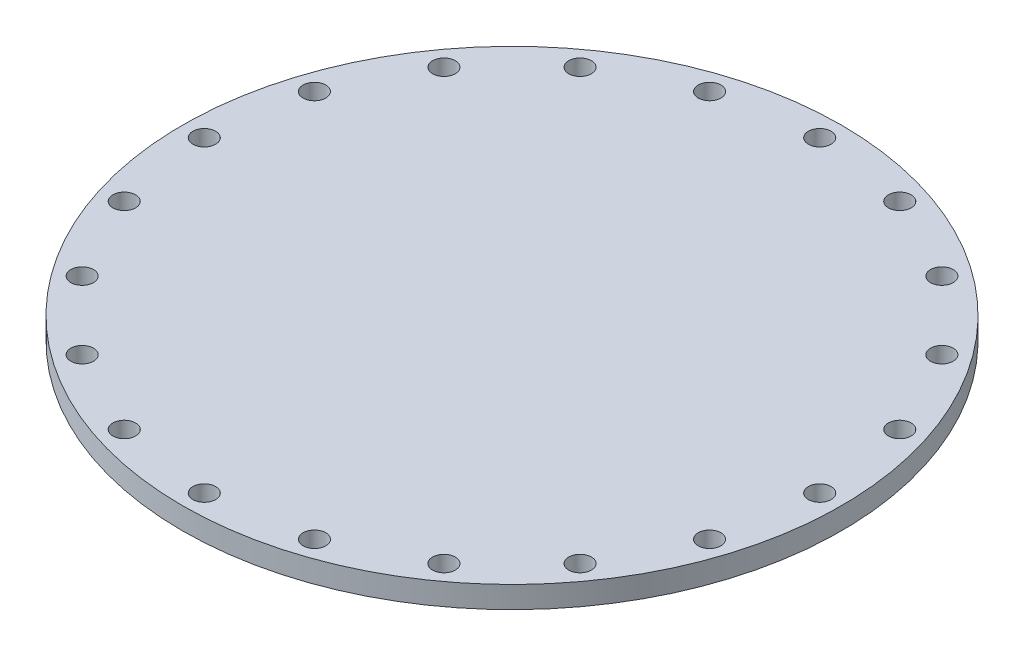
from build123d import *

# Parameters (mm, degrees)
SKETCH1_R           = 377.5
SKETCH1_R_2         = 13
BOSS_EXTRUDE1_DEPTH = 12.5


with BuildPart() as part:
    # Sketch1 → Boss-Extrude1 (new, symmetric)
    with BuildSketch(Plane(origin=(0, 0, 0), x_dir=(1, 0, 0), z_dir=(0, 1, 0))):
        with Locations(Location((0, 0, 0), (0, 0, 270))):
            Circle(SKETCH1_R)
        with Locations(Location((0, 352.5, 0), (0, 0, 270))):
            Circle(SKETCH1_R_2, mode=Mode.SUBTRACT)
        with Locations(Location((108.928490517, 335.247421994, 0), (0, 0, 270))):
            Circle(SKETCH1_R_2, mode=Mode.SUBTRACT)
        with Locations(Location((207.194301433, 285.178490517, 0), (0, 0, 270))):
            Circle(SKETCH1_R_2, mode=Mode.SUBTRACT)
        with Locations(Location((285.178490517, 207.194301433, 0), (0, 0, 270))):
            Circle(SKETCH1_R_2, mode=Mode.SUBTRACT)
        with Locations(Location((335.247421994, 108.928490517, 0), (0, 0, 270))):
            Circle(SKETCH1_R_2, mode=Mode.SUBTRACT)
        with Locations(Location((352.5, 0, 0), (0, 0, 270))):
            Circle(SKETCH1_R_2, mode=Mode.SUBTRACT)
        with Locations(Location((335.247421994, -108.928490517, 0), (0, 0, 270))):
            Circle(SKETCH1_R_2, mode=Mode.SUBTRACT)
        with Locations(Location((285.178490517, -207.194301433, 0), (0, 0, 270))):
            Circle(SKETCH1_R_2, mode=Mode.SUBTRACT)
        with Locations(Location((207.194301433, -285.178490517, 0), (0, 0, 270))):
            Circle(SKETCH1_R_2, mode=Mode.SUBTRACT)
        with Locations(Location((108.928490517, -335.247421994, 0), (0, 0, 270))):
            Circle(SKETCH1_R_2, mode=Mode.SUBTRACT)
        with Locations(Location((0, -352.5, 0), (0, 0, 270))):
            Circle(SKETCH1_R_2, mode=Mode.SUBTRACT)
        with Locations(Location((-108.928490517, -335.247421994, 0), (0, 0, 270))):
            Circle(SKETCH1_R_2, mode=Mode.SUBTRACT)
        with Locations(Location((-207.194301433, -285.178490517, 0), (0, 0, 270))):
            Circle(SKETCH1_R_2, mode=Mode.SUBTRACT)
        with Locations(Location((-285.178490517, -207.194301433, 0), (0, 0, 270))):
            Circle(SKETCH1_R_2, mode=Mode.SUBTRACT)
        with Locations(Location((-335.247421994, -108.928490517, 0), (0, 0, 270))):
            Circle(SKETCH1_R_2, mode=Mode.SUBTRACT)
        with Locations(Location((-352.5, 0, 0), (0, 0, 270))):
            Circle(SKETCH1_R_2, mode=Mode.SUBTRACT)
        with Locations(Location((-335.247421994, 108.928490517, 0), (0, 0, 270))):
            Circle(SKETCH1_R_2, mode=Mode.SUBTRACT)
        with Locations(Location((-285.178490517, 207.194301433, 0), (0, 0, 270))):
            Circle(SKETCH1_R_2, mode=Mode.SUBTRACT)
        with Locations(Location((-207.194301433, 285.178490517, 0), (0, 0, 270))):
            Circle(SKETCH1_R_2, mode=Mode.SUBTRACT)
        with Locations(Location((-108.928490517, 335.247421994, 0), (0, 0, 270))):
            Circle(SKETCH1_R_2, mode=Mode.SUBTRACT)
    extrude(amount=BOSS_EXTRUDE1_DEPTH, both=True)


solid = part.part
